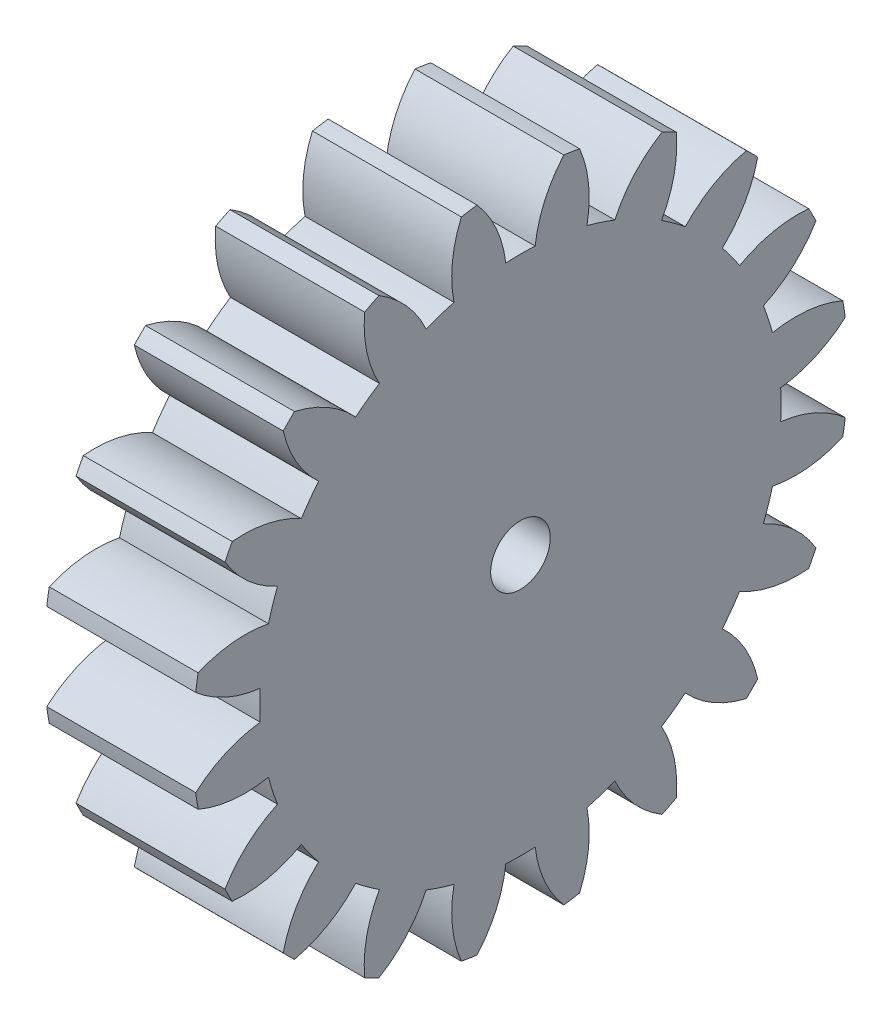
from build123d import *

# Parameters (mm, degrees)
BASPROSKE_W        = 10
BASPROSKE_H        = 22
TOOTHCUT_DEPTH     = 33.680269277
TEETHCUTS_COUNT    = 20
TEETHCUTS_ANGLE    = 342
BORSKE_R           = 0.4
BORE_DEPTH         = 50.0000508
CUT_EXTRUDE1_DEPTH = 6
SKETCH2_R          = 2
CUT_EXTRUDE2_DEPTH = 6
CUT_EXTRUDE3_DEPTH = 6


with BuildPart() as part:
    # BasProSke → Base-Revolve (revolve)
    with BuildSketch(Plane(origin=(0, 0, 0), x_dir=(1, 0, 0), z_dir=(0, 1, 0)), mode=Mode.PRIVATE) as base_revolve_sk:
        with Locations((5, 11)):
            Rectangle(BASPROSKE_W, BASPROSKE_H)
    revolve(base_revolve_sk.sketch.rotate(Axis((-10, 0, 0), (1, 0, 0)), 180), axis=Axis((-10, 0, 0), (1, 0, 0)))

    # TooCutSke → ToothCut (cut, through all)
    with BuildSketch(Plane(origin=(0, 0, 0), x_dir=(0, 0, -1), z_dir=(1, 0, 0))):
        with BuildLine():
            ThreePointArc((0.986171591, 17.471189616), (0, 17.499), (-0.986171591, 17.471189616))
            ThreePointArc((-0.986171591, 17.471189616), (-1.626916196, 19.798789858), (-2.932850173, 21.829260982))
            ThreePointArc((-2.932850173, 21.829260982), (0, 22.0254), (2.932850173, 21.829260982))
            ThreePointArc((2.932850173, 21.829260982), (1.626916196, 19.798789858), (0.986171591, 17.471189616))
        make_face()
    toothcut = extrude(amount=TOOTHCUT_DEPTH, mode=Mode.SUBTRACT)

    # TeethCuts: ToothCut ×20 about axis
    teethcuts_axis = Axis((-10, 0, 0), (1, 0, 0))
    for i in range(1, TEETHCUTS_COUNT):
        add(toothcut.rotate(teethcuts_axis, i * TEETHCUTS_ANGLE / (TEETHCUTS_COUNT - 1)), mode=Mode.SUBTRACT)

    # BorSke → Bore (cut, symmetric)
    with BuildSketch(Plane(origin=(0, 0, 0), x_dir=(0, 0, -1), z_dir=(1, 0, 0))):
        with Locations(Location((0, 0, 0), (0, 0, 180))):
            Circle(BORSKE_R)
    extrude(amount=BORE_DEPTH, both=True, mode=Mode.SUBTRACT)

    # Sketch1 → Cut-Extrude1 (cut)
    with BuildSketch(Plane.ZY):
        Polygon((-5.947236483, -3.553917279), (0.104168329, -6.927416915), (6.05140712, -3.373496436), (5.947241098, 3.553923678), (-0.104163715, 6.927423314), (-6.051402506, 3.373502835), align=None)
    extrude(amount=-CUT_EXTRUDE1_DEPTH, mode=Mode.SUBTRACT)

    # Sketch2 → Cut-Extrude2 (cut)
    with BuildSketch(Plane(origin=(10, 0, 0), x_dir=(0, 0, -1), z_dir=(1, 0, 0))):
        with Locations((-2.307e-06, 3.199e-06)):
            Circle(SKETCH2_R)
    extrude(amount=-CUT_EXTRUDE2_DEPTH, mode=Mode.SUBTRACT)

    # Sketch4 → Cut-Extrude3 (cut)
    with BuildSketch(Plane.ZY):
        Polygon((-6.346541022, 3.518535779), (-6.237773669, -3.714889608), (0.071344514, -7.232057695), (6.334133484, -3.489572357), (6.225545747, 3.731907869), (-0.094007056, 7.254892984), align=None)
    extrude(amount=-CUT_EXTRUDE3_DEPTH, mode=Mode.SUBTRACT)


solid = part.part
